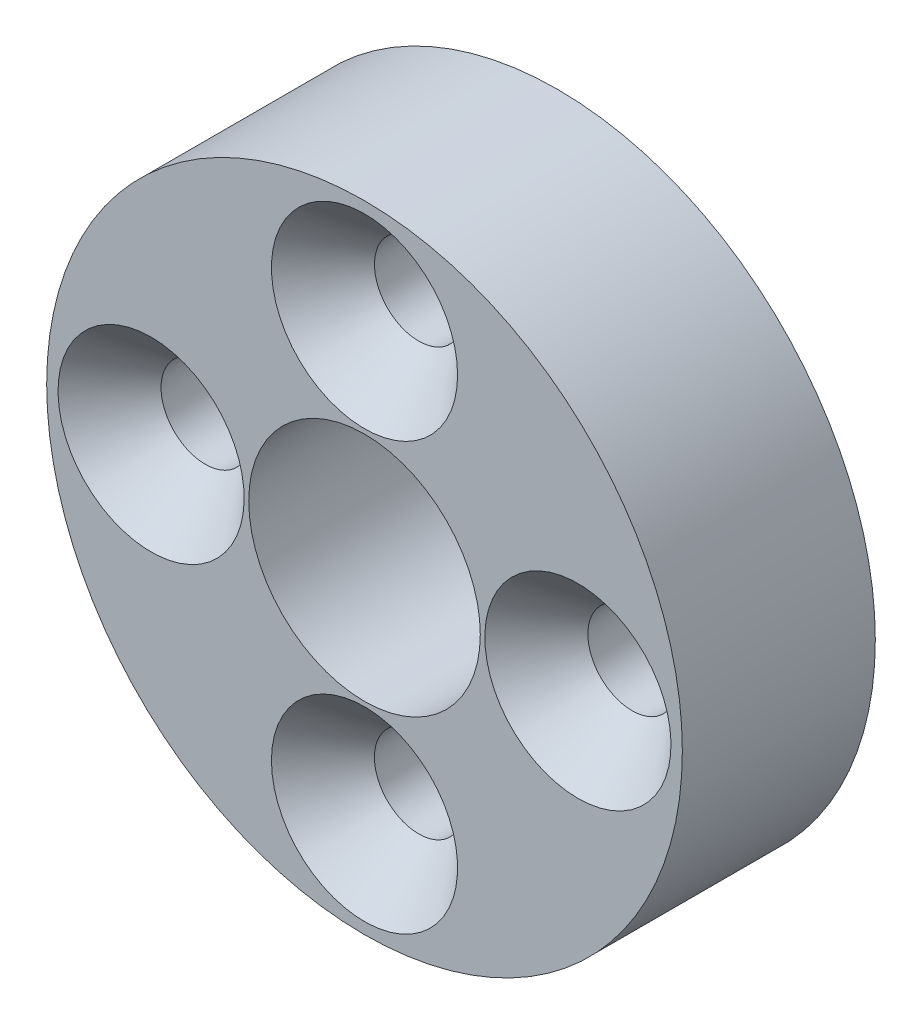
from build123d import *
from build123d.topology import SkipClean

# Parameters (mm, degrees)
SKETCH1_R           = 17.78
SKETCH1_R_2         = 2.4765
SKETCH1_R_3         = 6.477
BOSS_EXTRUDE1_DEPTH = 10.795
BOSS_EXTRUDE2_START = 3.175
SKETCH2_W           = 16.51
SKETCH2_H           = 16.51
SKETCH2_R           = 6.477
BOSS_EXTRUDE2_DEPTH = 3.175
CIRPATTERN4_COUNT   = 4


with BuildPart() as part:
    # Sketch1 → Boss-Extrude1 (new body)
    with BuildSketch(Plane.XY):
        Circle(SKETCH1_R)
        with Locations((-11.938, 0)):
            Circle(SKETCH1_R_2, mode=Mode.SUBTRACT)
        with Locations((0, -11.938)):
            Circle(SKETCH1_R_2, mode=Mode.SUBTRACT)
        with Locations((11.938, 0)):
            Circle(SKETCH1_R_2, mode=Mode.SUBTRACT)
        with Locations((0, 11.938)):
            Circle(SKETCH1_R_2, mode=Mode.SUBTRACT)
        Circle(SKETCH1_R_3, mode=Mode.SUBTRACT)
    extrude(amount=BOSS_EXTRUDE1_DEPTH)

    # Sketch2 → Boss-Extrude2 (add)
    with SkipClean():  # the faces are left unmerged after this step: merging them gives an invalid solid
        with BuildSketch(Plane(origin=(0, 0, 0), x_dir=(-1, 0, 0), z_dir=(0, 0, -1)).offset(BOSS_EXTRUDE2_START)):
            Rectangle(SKETCH2_W, SKETCH2_H)
            Circle(SKETCH2_R, mode=Mode.SUBTRACT)
        extrude(amount=-BOSS_EXTRUDE2_DEPTH)

    # Sketch5 → Cut-Revolve1 (revolve, cut)
    with SkipClean():  # the faces are left unmerged after this step: merging them gives an invalid solid
        with BuildSketch(Plane(origin=(0, 0, 0), x_dir=(0, 0, -1), z_dir=(1, 0, 0)), mode=Mode.PRIVATE) as cut_revolve1_sk:
            Polygon((-10.795, 11.938), (-10.795, 17.145), (-7.493, 14.171865846), (-7.493, 11.938), align=None)
        cut_revolve1 = revolve(cut_revolve1_sk.sketch.rotate(Axis((0, 11.938, 10.795), (0, 0, -1)), 90), axis=Axis((0, 11.938, 10.795), (0, 0, -1)), mode=Mode.SUBTRACT)

    # CirPattern4: Cut-Revolve1 ×4 about axis
    with SkipClean():  # the faces are left unmerged after this step: merging them gives an invalid solid
        cirpattern4_axis = Axis((0, 0, 0), (0, 0, 1))
        for i in range(1, CIRPATTERN4_COUNT):
            add(cut_revolve1.rotate(cirpattern4_axis, i * 360 / CIRPATTERN4_COUNT), mode=Mode.SUBTRACT)


solid = part.part
